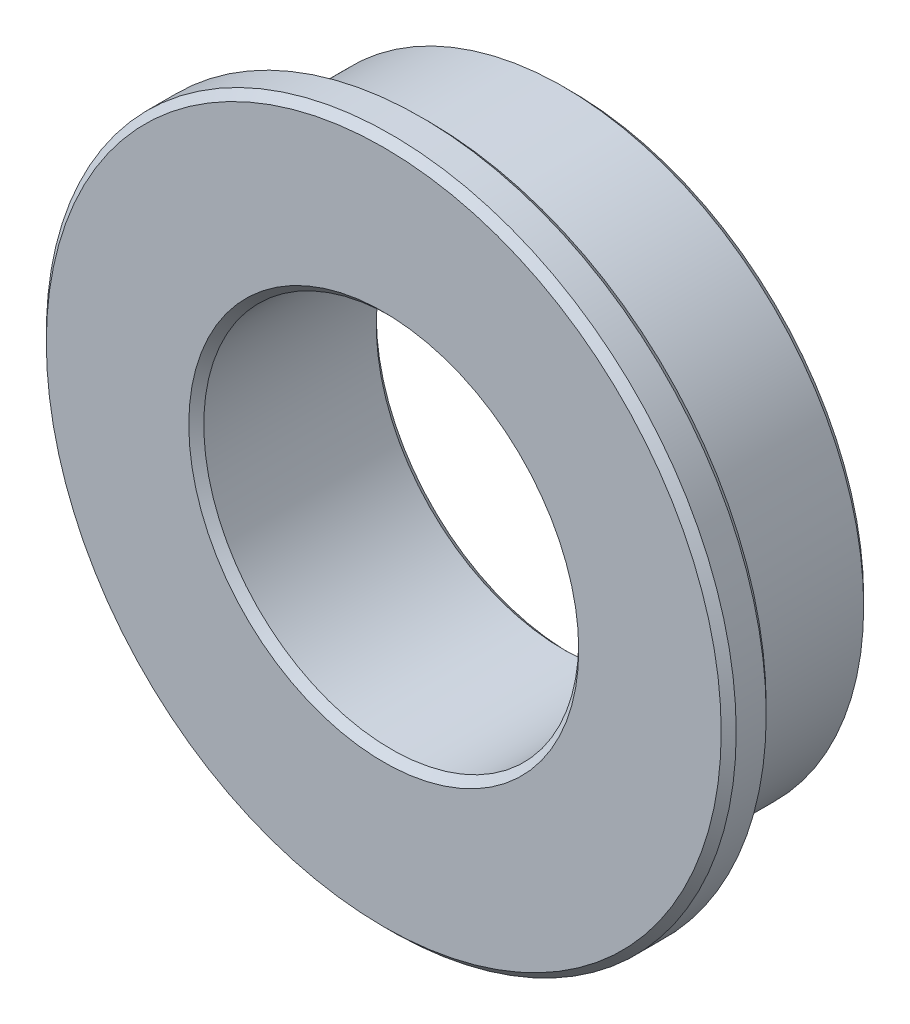
from build123d import *

# Parameters (mm, degrees)
BEARINGSKE_R   = 4
BEARINGSKE_R_2 = 2.5
BEARING_DEPTH  = 2.5
FLANGE_START   = -0.6
FLANGESKE_R    = 4.6
FLANGESKE_R_2  = 4
FLANGE_DEPTH   = 0.6
CHAMFER_2_SIZE = 0.1


with BuildPart() as part:
    # BearingSke → Bearing (new body)
    with BuildSketch(Plane.XY):
        Circle(BEARINGSKE_R)
        Circle(BEARINGSKE_R_2, mode=Mode.SUBTRACT)
    extrude(amount=BEARING_DEPTH)

    # FlangeSke → Flange (add)
    with BuildSketch(Plane.XY.offset(2.5).offset(FLANGE_START)):
        Circle(FLANGESKE_R)
        Circle(FLANGESKE_R_2, mode=Mode.SUBTRACT)
    extrude(amount=FLANGE_DEPTH)

    # Chamfer 2
    chamfer_2_edges = [part.edges().sort_by_distance(p)[0] for p in [
        (-4.6, 0, 1.9),
        (-4.6, 0, 2.5),
        (-4, 0, 0),
        (-2.5, 0, 0),
        (-2.5, 0, 2.5),
    ]]
    chamfer(chamfer_2_edges, length=CHAMFER_2_SIZE)


solid = part.part
